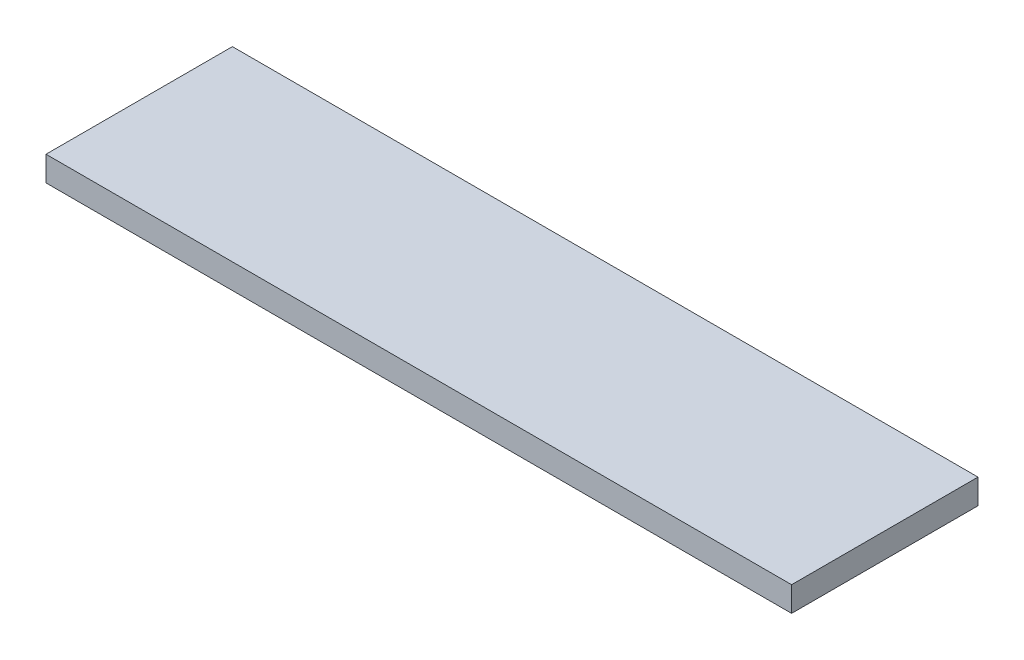
from build123d import *

# Parameters (mm, degrees)
SKETCH1_W           = 60
SKETCH1_H           = 15
BOSS_EXTRUDE1_DEPTH = 2


with BuildPart() as part:
    # Sketch1 → Boss-Extrude1 (new body)
    with BuildSketch(Plane(origin=(0, 0, 0), x_dir=(1, 0, 0), z_dir=(0, 1, 0))):
        Rectangle(SKETCH1_W, SKETCH1_H)
    extrude(amount=BOSS_EXTRUDE1_DEPTH)


solid = part.part
